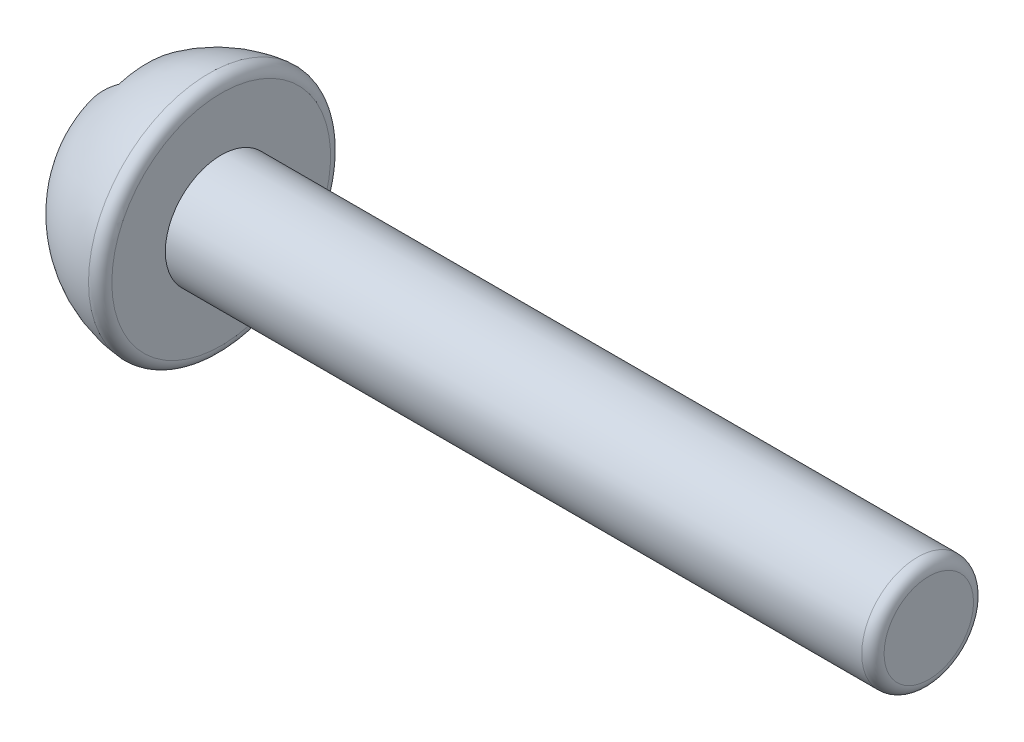
from build123d import *

# Parameters (mm, degrees)
CUT_EXTRUDE1_DEPTH = 3.81
FILLET1_R          = 0.762
SCALE1_SCALE       = 3


with BuildPart() as part:
    # Sketch1 → Revolve1 (revolve)
    with BuildSketch(Plane.XY, mode=Mode.PRIVATE) as revolve1_sk:
        with BuildLine():
            Line((0, 0), (57.15, 0))
            Line((57.15, 0), (57.15, 3.81))
            Line((57.15, 3.81), (8.89, 3.81))
            Line((8.89, 3.81), (8.89, 8.255))
            ThreePointArc((8.89, 8.255), (2.818084231, 5.879563136), (0, 0))
        make_face()
    revolve(revolve1_sk.sketch.rotate(Axis((0, 0, 0), (1, 0, 0)), 90), axis=Axis((0, 0, 0), (1, 0, 0)))

    # Sketch3 → Cut-Extrude1 (cut)
    with BuildSketch(Plane(origin=(0, 0, 0), x_dir=(0, 0, -1), z_dir=(1, 0, 0))):
        with BuildLine():
            Line((1.905, -3.661588624), (1.905, -6.985))
            Line((1.905, -6.985), (-1.905, -6.985))
            Line((-1.905, -6.985), (-1.905, -3.661588624))
            ThreePointArc((-1.905, -3.661588624), (-3.829921876, 0), (-1.905, 3.661588624))
            Line((-1.905, 3.661588624), (-1.905, 6.985))
            Line((-1.905, 6.985), (1.905, 6.985))
            Line((1.905, 6.985), (1.905, 3.661588624))
            ThreePointArc((1.905, 3.661588624), (3.829921876, 0), (1.905, -3.661588624))
        make_face()
    extrude(amount=CUT_EXTRUDE1_DEPTH, mode=Mode.SUBTRACT)

    # Fillet1
    fillet1_edges = [part.edges().sort_by_distance(p)[0] for p in [
        (8.89, 0, -8.255),
        (57.15, 0, -3.81),
    ]]
    fillet(fillet1_edges, radius=FILLET1_R)


with BuildPart() as part_1:
    # Scale1: scaled about (24.334751601, 6e-09, -5e-09)
    add(part.part.scale(SCALE1_SCALE).moved(Location((-48.669503202, -1.2e-08, 1e-08))))


solid = part_1.part
